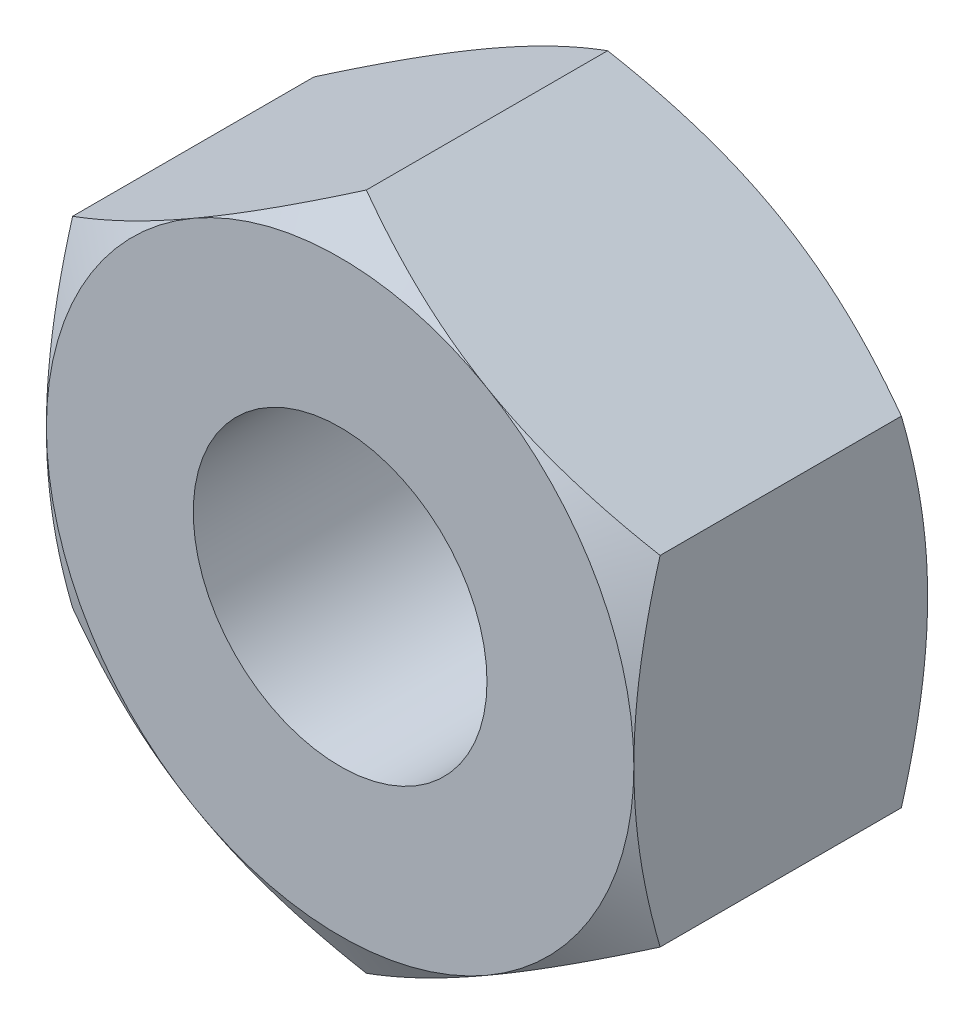
from build123d import *

# Parameters (mm, degrees)
SKETCH1_R           = 6
BOSS_EXTRUDE1_DEPTH = 12
SKETCH3_OUTSIDE_W   = 154.958
SKETCH3_OUTSIDE_H   = 158.67
SKETCH3_OUTSIDE_R   = 12
CUT_EXTRUDE1_DEPTH  = 35
CUT_EXTRUDE1_DRAFT  = -60
SKETCH4_OUTSIDE_W   = 154.958
SKETCH4_OUTSIDE_H   = 158.67
SKETCH4_OUTSIDE_R   = 12
CUT_EXTRUDE2_DEPTH  = 35
CUT_EXTRUDE2_DRAFT  = -60


with BuildPart() as part:
    # Sketch1 → Boss-Extrude1 (new body)
    with BuildSketch(Plane.XY):
        Polygon((0, 13.856406461), (-12, 6.92820323), (-12, -6.92820323), (0, -13.856406461), (12, -6.92820323), (12, 6.92820323), align=None)
        Circle(SKETCH1_R, mode=Mode.SUBTRACT)
    extrude(amount=BOSS_EXTRUDE1_DEPTH)


with BuildPart() as cut_extrude1_tool:
    # Sketch3 outside → Cut-Extrude1 (with draft: the straight prism first)
    with BuildSketch(Plane(origin=(0, 0, 0), x_dir=(-1, 0, 0), z_dir=(0, 0, -1))):
        Rectangle(SKETCH3_OUTSIDE_W, SKETCH3_OUTSIDE_H)
        Circle(SKETCH3_OUTSIDE_R, mode=Mode.SUBTRACT)
    extrude(amount=-CUT_EXTRUDE1_DEPTH)
    # Cut-Extrude1: the draft: its side faces are tilted about the plane it starts from
    cut_extrude1_sides = [cut_extrude1_tool.faces().sort_by_distance(p)[0] for p in [
        (0, -79.335, 17.5),
        (-77.479, 0, 17.5),
        (0, 79.335, 17.5),
        (77.479, 0, 17.5),
        (12, 0, 17.5),
    ]]
    draft(cut_extrude1_sides, Plane(origin=(0, 0, 0), x_dir=(-1, 0, 0), z_dir=(0, 0, -1)), CUT_EXTRUDE1_DRAFT)


with BuildPart() as part_1:
    add(part.part)

    # Cut-Extrude1: cut by cut_extrude1_tool
    add(cut_extrude1_tool.part, mode=Mode.SUBTRACT)


with BuildPart() as cut_extrude2_tool:
    # Sketch4 outside → Cut-Extrude2 (with draft: the straight prism first)
    with BuildSketch(Plane.XY.offset(12)):
        Rectangle(SKETCH4_OUTSIDE_W, SKETCH4_OUTSIDE_H)
        Circle(SKETCH4_OUTSIDE_R, mode=Mode.SUBTRACT)
    extrude(amount=-CUT_EXTRUDE2_DEPTH)
    # Cut-Extrude2: the draft: its side faces are tilted about the plane it starts from
    cut_extrude2_sides = [cut_extrude2_tool.faces().sort_by_distance(p)[0] for p in [
        (0, -79.335, -5.5),
        (77.479, 0, -5.5),
        (0, 79.335, -5.5),
        (-77.479, 0, -5.5),
        (-12, 0, -5.5),
    ]]
    draft(cut_extrude2_sides, Plane.XY.offset(12), CUT_EXTRUDE2_DRAFT)


with BuildPart() as part_2:
    add(part_1.part)

    # Cut-Extrude2: cut by cut_extrude2_tool
    add(cut_extrude2_tool.part, mode=Mode.SUBTRACT)


solid = part_2.part
